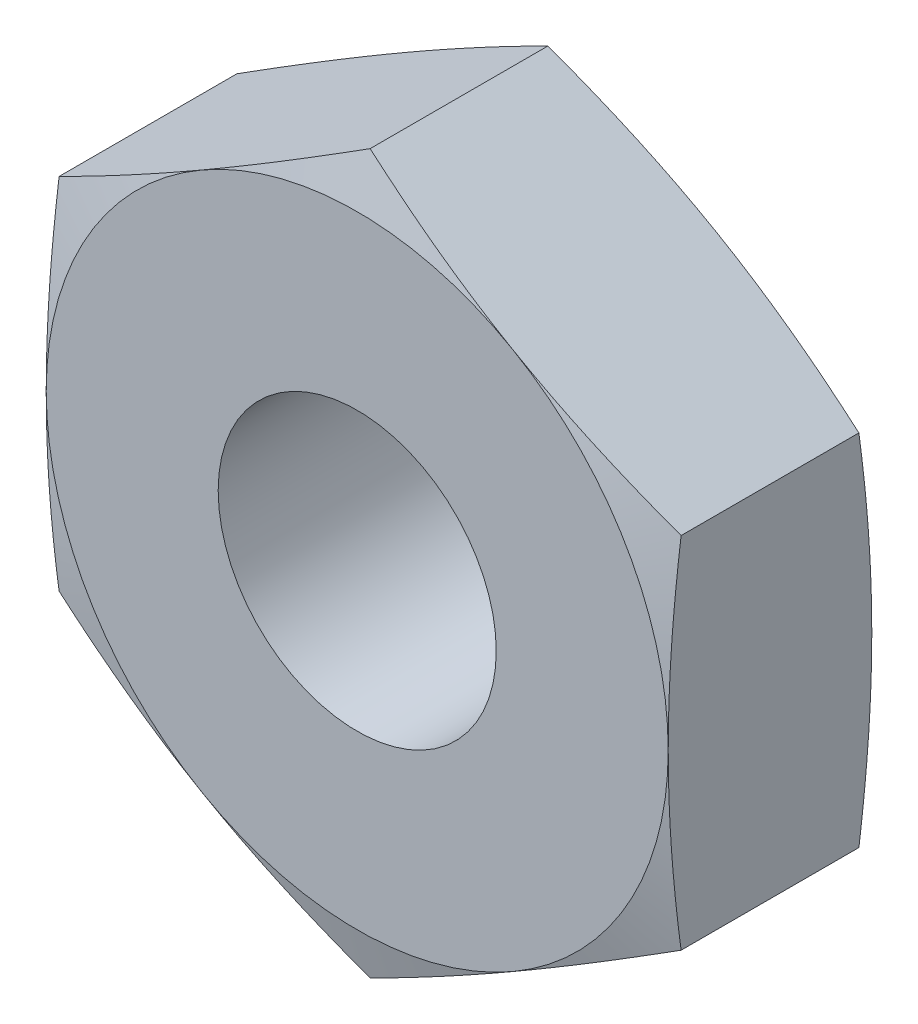
from build123d import *

# Parameters (mm, degrees)
SKETCH_1_R          = 1.229375
EXTRUDE_580_DEPTH   = 1.8
SKETCH_2_OUTSIDE_W  = 50.794
SKETCH_2_OUTSIDE_H  = 51.644
SKETCH_2_OUTSIDE_R  = 2.75
CUT_EXTRUDE_1_DEPTH = 5.570102114
CUT_EXTRUDE_1_DRAFT = -75
SKETCH_3_OUTSIDE_W  = 50.794
SKETCH_3_OUTSIDE_H  = 51.644
SKETCH_3_OUTSIDE_R  = 2.75
CUT_EXTRUDE_2_DEPTH = 5.570102114
CUT_EXTRUDE_2_DRAFT = -75


with BuildPart() as part:
    # 草图1 → Extrude 580 (new body)
    with BuildSketch(Plane.XY):
        Polygon((0, 3.175426481), (-2.75, 1.58771324), (-2.75, -1.58771324), (0, -3.175426481), (2.75, -1.58771324), (2.75, 1.58771324), align=None)
        Circle(SKETCH_1_R, mode=Mode.SUBTRACT)
    extrude(amount=EXTRUDE_580_DEPTH)


with BuildPart() as cut_extrude_1_tool:
    # 草图2 outside → 切除-拉伸1 (with draft: the straight prism first)
    with BuildSketch(Plane(origin=(0, 0, 0), x_dir=(-1, 0, 0), z_dir=(0, 0, -1))):
        Rectangle(SKETCH_2_OUTSIDE_W, SKETCH_2_OUTSIDE_H)
        Circle(SKETCH_2_OUTSIDE_R, mode=Mode.SUBTRACT)
    extrude(amount=-CUT_EXTRUDE_1_DEPTH)
    # 切除-拉伸1: the draft: its side faces are tilted about the plane it starts from
    cut_extrude_1_sides = [cut_extrude_1_tool.faces().sort_by_distance(p)[0] for p in [
        (0, -25.822, 2.785051057),
        (-25.397, 0, 2.785051057),
        (0, 25.822, 2.785051057),
        (25.397, 0, 2.785051057),
        (2.75, 0, 2.785051057),
    ]]
    draft(cut_extrude_1_sides, Plane(origin=(0, 0, 0), x_dir=(-1, 0, 0), z_dir=(0, 0, -1)), CUT_EXTRUDE_1_DRAFT)


with BuildPart() as part_1:
    add(part.part)

    # 切除-拉伸1: cut by cut_extrude_1_tool
    add(cut_extrude_1_tool.part, mode=Mode.SUBTRACT)


with BuildPart() as cut_extrude_2_tool:
    # 草图3 outside → 切除-拉伸2 (with draft: the straight prism first)
    with BuildSketch(Plane.XY.offset(1.8)):
        Rectangle(SKETCH_3_OUTSIDE_W, SKETCH_3_OUTSIDE_H)
        Circle(SKETCH_3_OUTSIDE_R, mode=Mode.SUBTRACT)
    extrude(amount=-CUT_EXTRUDE_2_DEPTH)
    # 切除-拉伸2: the draft: its side faces are tilted about the plane it starts from
    cut_extrude_2_sides = [cut_extrude_2_tool.faces().sort_by_distance(p)[0] for p in [
        (0, -25.822, -0.985051057),
        (25.397, 0, -0.985051057),
        (0, 25.822, -0.985051057),
        (-25.397, 0, -0.985051057),
        (-2.75, 0, -0.985051057),
    ]]
    draft(cut_extrude_2_sides, Plane.XY.offset(1.8), CUT_EXTRUDE_2_DRAFT)


with BuildPart() as part_2:
    add(part_1.part)

    # 切除-拉伸2: cut by cut_extrude_2_tool
    add(cut_extrude_2_tool.part, mode=Mode.SUBTRACT)


solid = part_2.part
